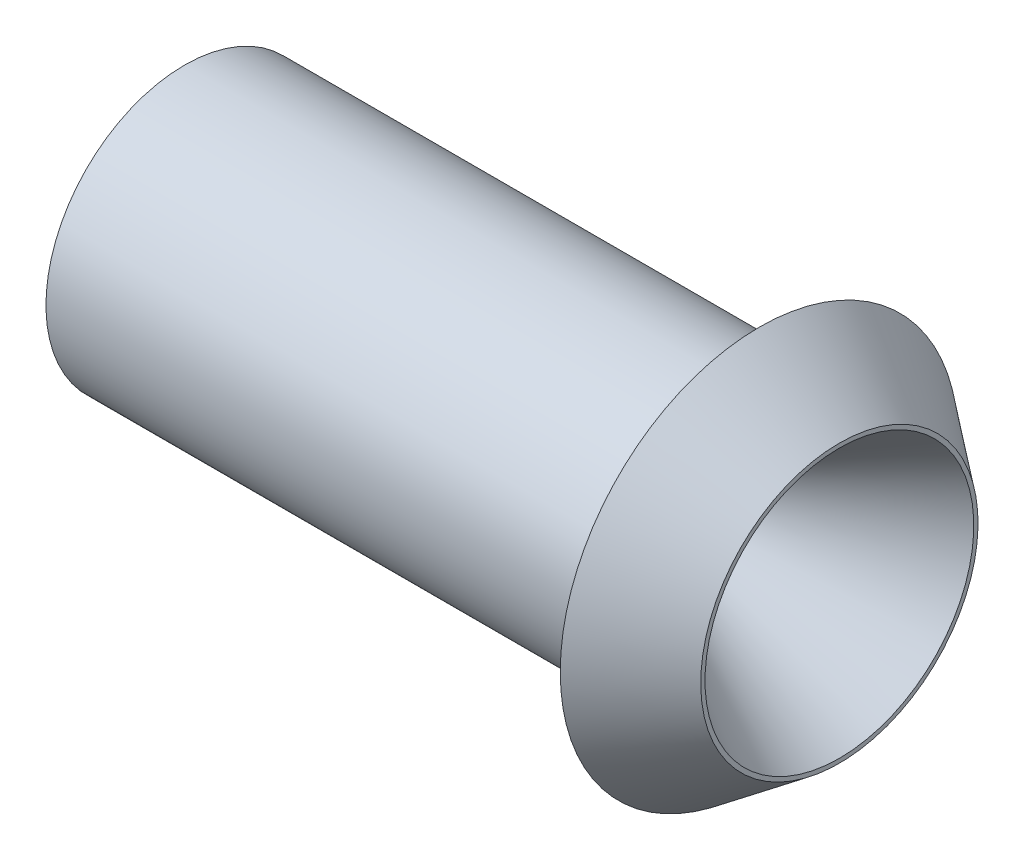
from build123d import *


with BuildPart() as part:
    # Sketch1 → Revolve1 (revolve)
    with BuildSketch(Plane.XY):
        Polygon((0, 8.255), (0, 8.001), (28.889339451, 2.90703), (30.159339451, 2.90703), (38.982354303, 8.001), (38.982354303, 8.255), (34.21282251, 11.8491), (34.21282251, 8.255), align=None)
    revolve(axis=Axis((38.982354303, 0, 0), (-1, 0, 0)))


solid = part.part
